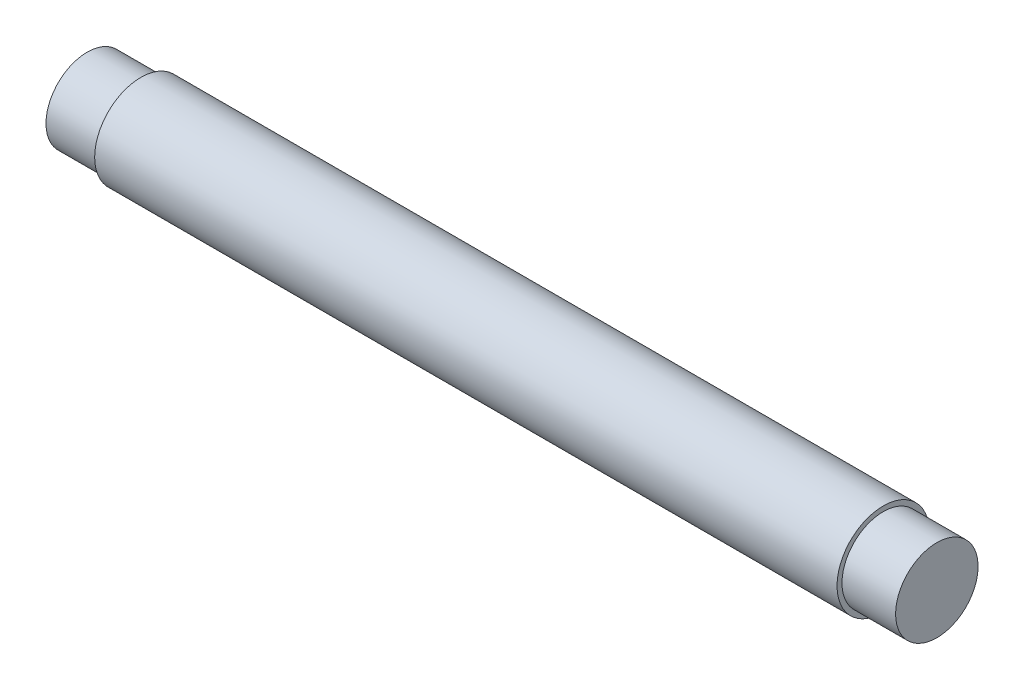
from build123d import *


with BuildPart() as part:
    # Sketch1 → Revolve1 (revolve)
    with BuildSketch(Plane.XY, mode=Mode.PRIVATE) as revolve1_sk:
        Polygon((-65.405, 0), (65.405, 0), (65.405, 6.35), (57.15, 6.35), (57.15, 7.112), (-57.15, 7.112), (-57.15, 6.35), (-65.405, 6.35), align=None)
    revolve(revolve1_sk.sketch.rotate(Axis((0, 0, 0), (1, 0, 0)), 90), axis=Axis((0, 0, 0), (1, 0, 0)))


solid = part.part
